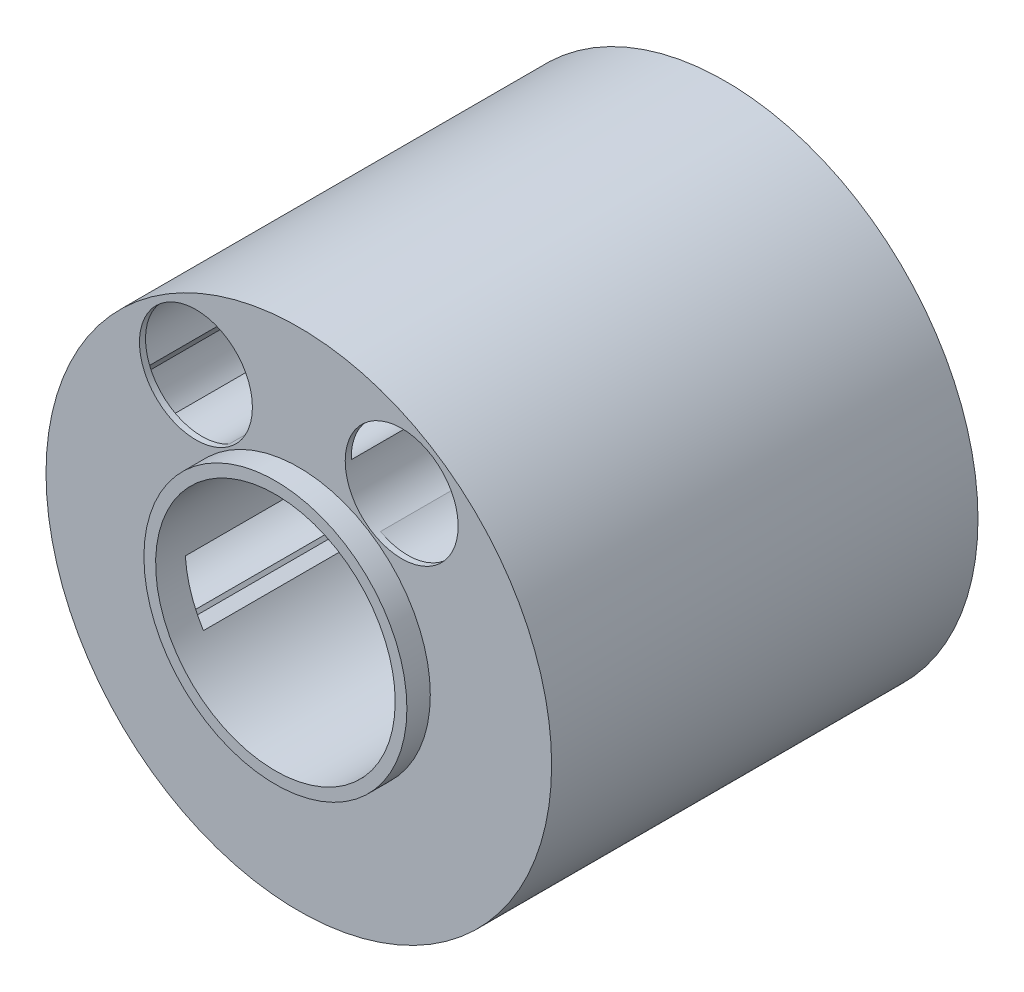
from build123d import *

# Parameters (mm, degrees)
SKETCH1_R                  = 43.2
SKETCH1_R_2                = 20.47
BASIC_SHAPE_DEPTH          = 67.03
SKETCH2_R                  = 9.65
BATTERY_SLOT_DEPTH         = 67.03
BATTERY_SLOT_PATTERN_COUNT = 10
SKETCH4_R                  = 35.78
SKETCH4_R_2                = 29.28
BUS_SLOT_DEPTH             = 67.03
SKETCH5_R                  = 43.2
SKETCH5_R_2                = 42.18
SKETCH5_R_3                = 22.47
SKETCH5_R_4                = 20.47
BOTTOM_LIP_DEPTH           = 4.8
SKETCH6_R                  = 43.2
TOP_CAP_DEPTH              = 1.03
SKETCH7_R                  = 9.65
PENNY_HOLE_DEPTH           = 96.084486642
WIRE_START                 = -67.03
WIRE_SLIT_DEPTH            = 159.488425528
SKETCH9_R                  = 20.47
RE_CUT_BASIC_SHAPE_DEPTH   = 95.297555111
SKETCH10_R                 = 22.47
SKETCH10_R_2               = 20.47
TOP_LIP_DEPTH              = 4


with BuildPart() as part:
    # Sketch1 → Basic Shape (new body)
    with BuildSketch(Plane.XY):
        Circle(SKETCH1_R)
        Circle(SKETCH1_R_2, mode=Mode.SUBTRACT)
    extrude(amount=BASIC_SHAPE_DEPTH)

    # Sketch2 → Battery Slot (cut)
    with BuildSketch(Plane(origin=(0, 0, 0), x_dir=(-1, 0, 0), z_dir=(0, 0, -1))):
        with Locations((0, -32.53)):
            Circle(SKETCH2_R)
    battery_slot = extrude(amount=-BATTERY_SLOT_DEPTH, mode=Mode.SUBTRACT)

    # Battery Slot Pattern: Battery Slot ×10 about axis
    battery_slot_pattern_axis = Axis((0, 0, 0), (0, 0, 1))
    for i in range(1, BATTERY_SLOT_PATTERN_COUNT):
        add(battery_slot.rotate(battery_slot_pattern_axis, i * 360 / BATTERY_SLOT_PATTERN_COUNT), mode=Mode.SUBTRACT)

    # Sketch4 → Bus Slot (cut)
    with BuildSketch(Plane(origin=(0, 0, 0), x_dir=(-1, 0, 0), z_dir=(0, 0, -1))):
        Circle(SKETCH4_R)
        Circle(SKETCH4_R_2, mode=Mode.SUBTRACT)
    extrude(amount=-BUS_SLOT_DEPTH, mode=Mode.SUBTRACT)


with BuildPart() as bus_slot_piece_1:
    # of the separate pieces the step leaves, piece 1, a body of its own (bus_slot_pieces)
    add(part.part.solids().sort_by_distance((43.2, 0, 0))[0])



with BuildPart() as bus_slot_piece_2:
    # of the separate pieces the step leaves, piece 2, a body of its own (bus_slot_pieces)
    add(part.part.solids().sort_by_distance((-8.526505578, -28.011017522, 0))[0])


with BuildPart() as bus_slot_piece_1_1:
    add(bus_slot_piece_1.part)

    add(bus_slot_piece_2.part)  # Bottom Lip merges Bus Slot piece 2
    # Sketch5 → Bottom Lip (add)
    # profile 1 of 2: a face of its own
    with BuildSketch(Plane(origin=(0, 0, 0), x_dir=(-1, 0, 0), z_dir=(0, 0, -1))):
        Circle(SKETCH5_R)
        with Locations(Location((0, 0, 0), (0, 0, 198))):
            Circle(SKETCH5_R_2, mode=Mode.SUBTRACT)
    # profile 2 of 2: a face of its own
    with BuildSketch(Plane(origin=(0, 0, 0), x_dir=(-1, 0, 0), z_dir=(0, 0, -1))):
        Circle(SKETCH5_R_3)
        Circle(SKETCH5_R_4, mode=Mode.SUBTRACT)
    extrude(amount=BOTTOM_LIP_DEPTH)

    # Sketch6 → Top Cap (add)
    with BuildSketch(Plane.XY.offset(67.03)):
        with Locations(Location((0, 0, 0), (0, 0, 180))):
            Circle(SKETCH6_R)
    extrude(amount=TOP_CAP_DEPTH)

    # Sketch7 → Penny Hole (cut, through all)
    with BuildSketch(Plane.XY.offset(68.06)):
        with Locations((-17.578795082, 27.371278075)):
            Circle(SKETCH7_R)
    penny_hole = extrude(amount=-PENNY_HOLE_DEPTH, mode=Mode.SUBTRACT)

    # Penny Hole Mirror: Penny Hole across plane
    add(penny_hole.mirror(Plane(origin=(0, 0, 0), x_dir=(0, 0, 1), z_dir=(1, 0, 0))), mode=Mode.SUBTRACT)

    # Sketch8 → Wire Slit (cut)
    with BuildSketch(Plane(origin=(0, 0, 0), x_dir=(-1, 0, 0), z_dir=(0, 0, -1)).offset(WIRE_START)):
        with BuildLine():
            Line((-24.633279562, -2.746526591), (-7.790722211, 2.725952027))
            Line((-7.790722211, 2.725952027), (-4.700552267, -6.784613136))
            Line((-4.700552267, -6.784613136), (-21.543109618, -12.257091754))
            ThreePointArc((-21.543109618, -12.257091754), (-21.760173093, -7.070308831), (-24.633279562, -2.746526591))
        make_face()
    wire_slit = extrude(amount=WIRE_SLIT_DEPTH, mode=Mode.SUBTRACT)

    # Wire Slit Mirror: Wire Slit across plane
    add(wire_slit.mirror(Plane(origin=(0, 0, 0), x_dir=(0, 0, 1), z_dir=(1, 0, 0))), mode=Mode.SUBTRACT)

    # Sketch9 → Re-Cut Basic Shape (cut, through all)
    with BuildSketch(Plane(origin=(0, 0, 67.03), x_dir=(-1, 0, 0), z_dir=(0, 0, -1))):
        Circle(SKETCH9_R)
    extrude(amount=-RE_CUT_BASIC_SHAPE_DEPTH, mode=Mode.SUBTRACT)

    # Sketch10 → Top Lip (add)
    with BuildSketch(Plane.XY.offset(68.06)):
        Circle(SKETCH10_R)
        with Locations(Location((0, 0, 0), (0, 0, 183.861900093))):
            Circle(SKETCH10_R_2, mode=Mode.SUBTRACT)
    extrude(amount=TOP_LIP_DEPTH)


solid = bus_slot_piece_1_1.part
